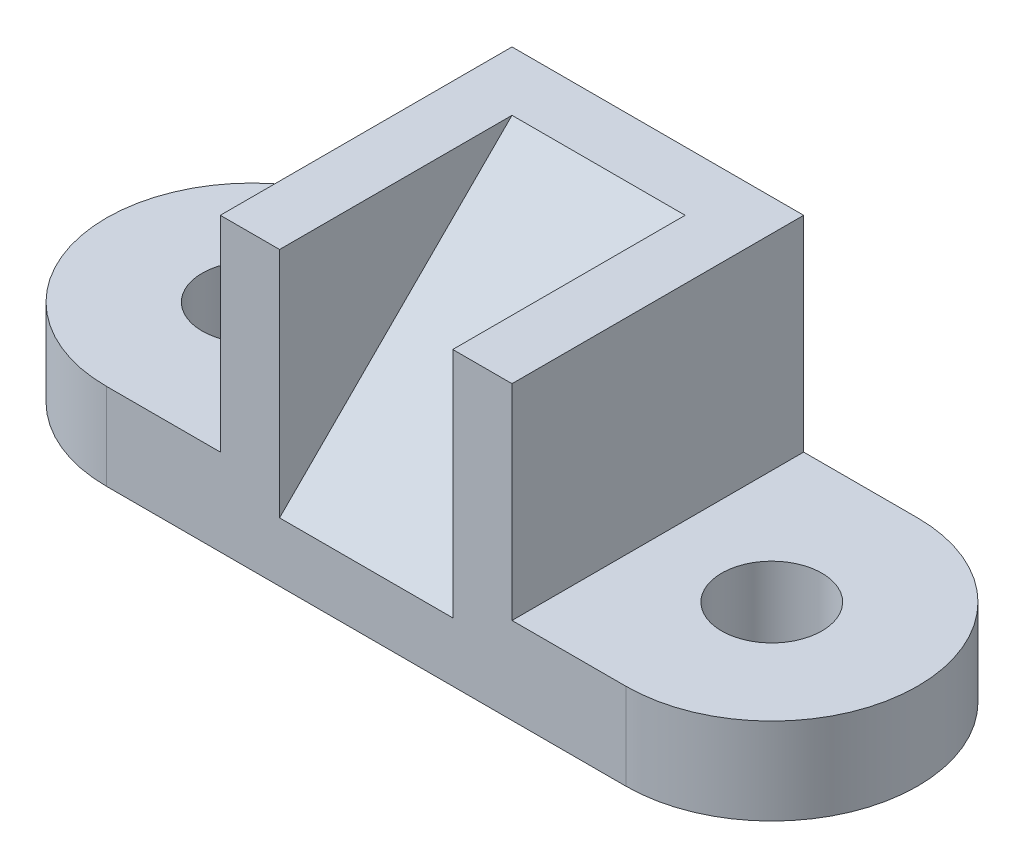
from build123d import *

# Parameters (mm, degrees)
SKETCH1_R           = 11
BOSS_EXTRUDE1_DEPTH = 19
BOSS_EXTRUDE2_DEPTH = 45
SKETCH3_W           = 38
SKETCH3_H           = 6
CUT_EXTRUDE1_DEPTH  = 51
BOSS_EXTRUDE4_DEPTH = 38


with BuildPart() as part:
    # Sketch1 → Boss-Extrude1 (new body)
    with BuildSketch(Plane(origin=(0, 0, 0), x_dir=(1, 0, 0), z_dir=(0, 1, 0))):
        with BuildLine():
            Line((0, 0), (114, 0))
            ThreePointArc((114, 0), (146, 32), (114, 64))
            Line((114, 64), (0, 64))
            ThreePointArc((0, 64), (-32, 32), (0, 0))
        make_face()
        with Locations(Location((0, 32, 0), (0, 0, 270))):
            Circle(SKETCH1_R, mode=Mode.SUBTRACT)
        with Locations(Location((114, 32, 0), (0, 0, 270))):
            Circle(SKETCH1_R, mode=Mode.SUBTRACT)
    extrude(amount=BOSS_EXTRUDE1_DEPTH)

    # Sketch2 → Boss-Extrude2 (add)
    with BuildSketch(Plane(origin=(0, 19, 0), x_dir=(1, 0, 0), z_dir=(0, 1, 0))):
        Polygon((89, 64), (25, 64), (25, 0), (38, 0), (38, 51), (76, 51), (76, 0), (89, 0), align=None)
    extrude(amount=BOSS_EXTRUDE2_DEPTH)

    # Sketch3 → Cut-Extrude1 (cut)
    with BuildSketch(Plane.XY):
        with Locations((57, 16)):
            Rectangle(SKETCH3_W, SKETCH3_H)
    extrude(amount=-CUT_EXTRUDE1_DEPTH, mode=Mode.SUBTRACT)

    # Sketch8 → Boss-Extrude4 (add)
    with BuildSketch(Plane(origin=(38, 0, 0), x_dir=(0, 0, -1), z_dir=(1, 0, 0))):
        Polygon((51, 64), (0, 13), (51, 13), align=None)
    extrude(amount=BOSS_EXTRUDE4_DEPTH)


solid = part.part
